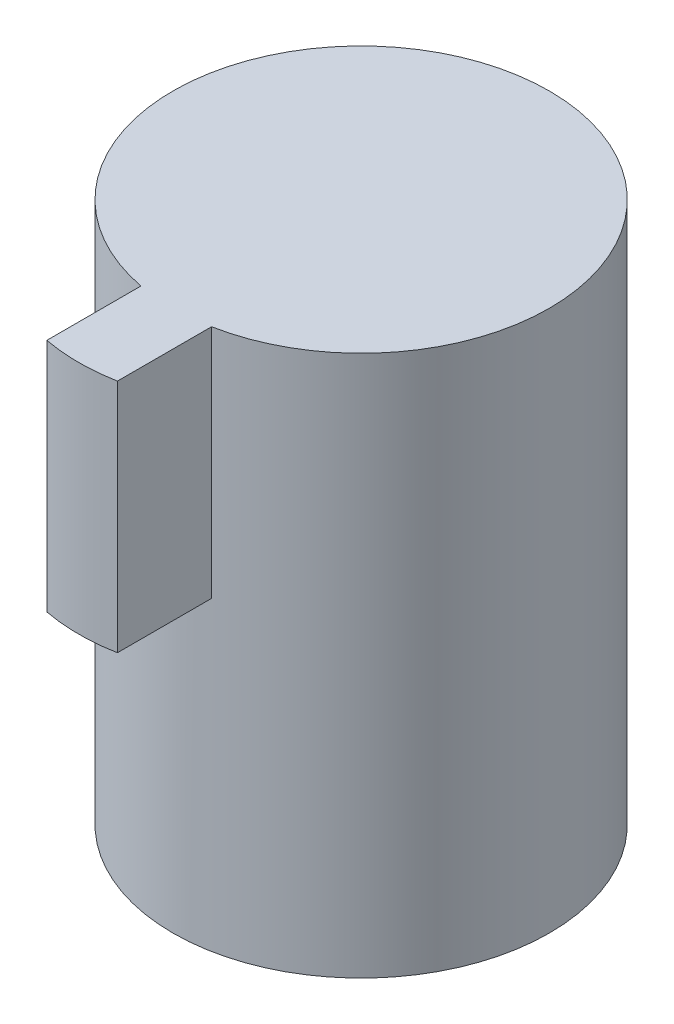
from build123d import *

# Parameters (mm, degrees)
BOSS_EXTRU_1_REACH        = 16.816
BOSS_EXTRU_1_START_RADIUS = 4
BOSS_EXTRU_1_END_RADIUS   = 4
ESQUISSE2_W               = 1.5
ESQUISSE2_H               = 5


with BuildPart() as part:
    # Esquisse1 → Révolution1 (revolve)
    with BuildSketch(Plane.XY):
        Polygon((2.5, 0), (2.5, 10), (0, 10), (0, 11.5), (4, 11.5), (4, 0), align=None)
    revolve(axis=Axis((0, 0, 0), (0, 1, 0)))

    # Boss.-Extru.1: from a cylinder face, 16.816 long prism both ways, kept between that surface and its translate by the depth
    boss_extru_1_start = Plane(origin=(0, 9, 0), z_dir=(0, -1, 0)) * Cylinder(BOSS_EXTRU_1_START_RADIUS, 42.632, mode=Mode.PRIVATE)
    boss_extru_1_end = Plane(origin=(0, 9, 2), z_dir=(0, -1, 0)) * Cylinder(BOSS_EXTRU_1_END_RADIUS, 42.632, mode=Mode.PRIVATE)
    # Esquisse2 → Boss.-Extru.1 (add, from a surface)
    with BuildSketch(Plane.XY, mode=Mode.PRIVATE) as boss_extru_1_sk1:
        with Locations((0, 9)):
            Rectangle(ESQUISSE2_W, ESQUISSE2_H)
    boss_extru_1_tool1 = extrude(boss_extru_1_sk1.sketch, amount=BOSS_EXTRU_1_REACH, both=True, mode=Mode.PRIVATE)
    add(((boss_extru_1_tool1 - boss_extru_1_start) & boss_extru_1_end).solids().sort_by_distance((0, 9, 4.929058))[0])


solid = part.part
